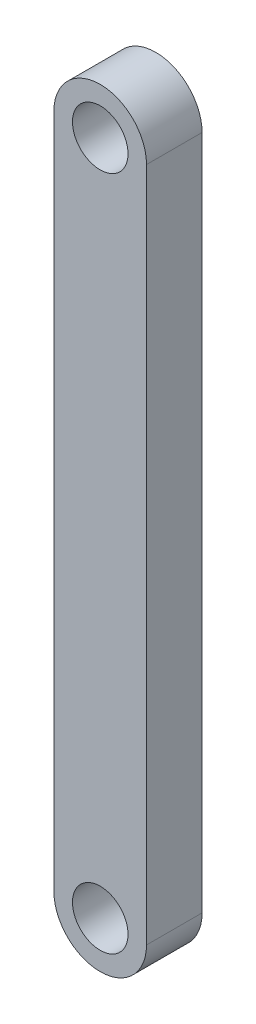
from build123d import *

# Parameters (mm, degrees)
SKETCH1_R           = 15
BOSS_EXTRUDE1_DEPTH = 30


with BuildPart() as part:
    # Sketch1 → Boss-Extrude1 (new body)
    with BuildSketch(Plane.XY):
        with BuildLine():
            Line((-25, 0), (-25, 365))
            ThreePointArc((-25, 365), (0, 390), (25, 365))
            Line((25, 365), (25, 0))
            ThreePointArc((25, 0), (0, -25), (-25, 0))
        make_face()
        with Locations((0, 365)):
            Circle(SKETCH1_R, mode=Mode.SUBTRACT)
        Circle(SKETCH1_R, mode=Mode.SUBTRACT)
    extrude(amount=BOSS_EXTRUDE1_DEPTH)


solid = part.part
